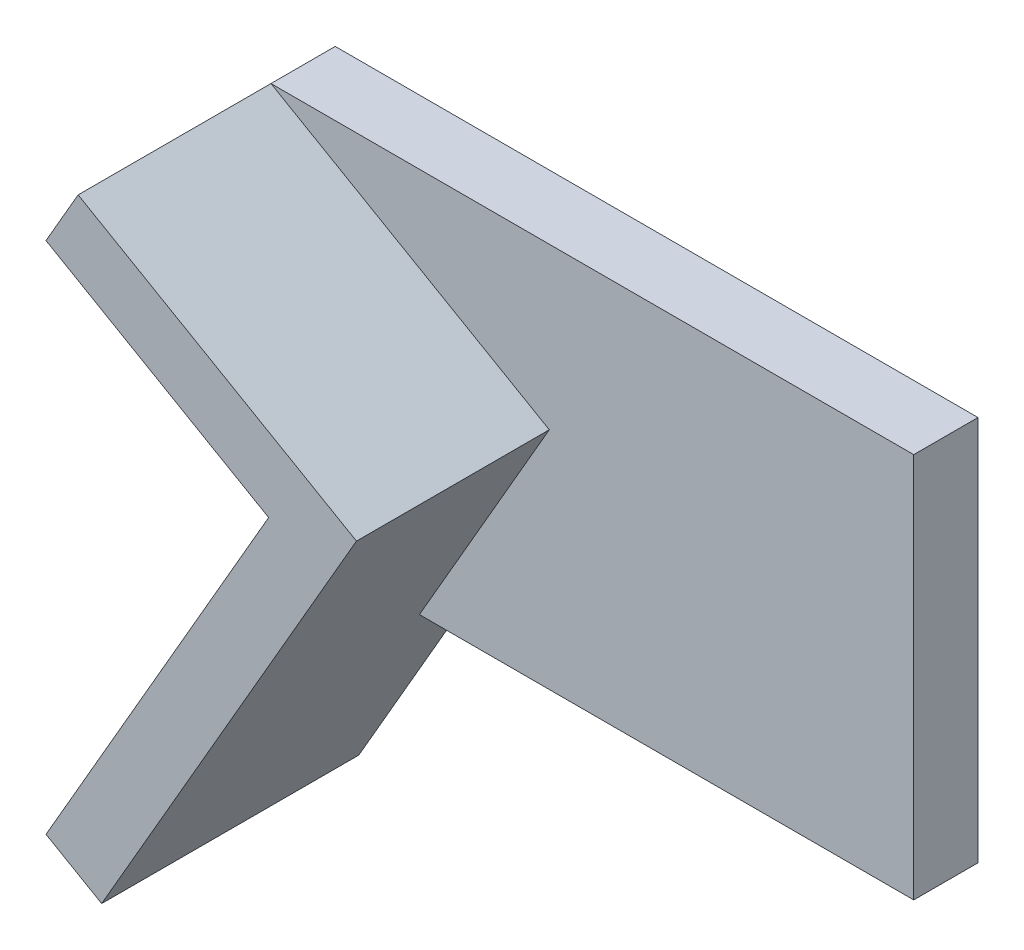
from build123d import *

# Parameters (mm, degrees)
BOSS_EXTRUDE1_DEPTH = 4
BOSS_EXTRUDE2_DEPTH = 1


with BuildPart() as part:
    # Sketch1 → Boss-Extrude1 (new body)
    with BuildSketch(Plane.XY):
        Polygon((0, 0), (3.464101615, 6), (0, 8), (0.5, 8.866025404), (4.830127019, 6.366025404), (0.866025404, -0.5), align=None)
    extrude(amount=BOSS_EXTRUDE1_DEPTH)

    # Sketch2 → Boss-Extrude2 (add)
    with BuildSketch(Plane(origin=(0, 0, 0), x_dir=(-1, 0, 0), z_dir=(0, 0, -1))):
        Polygon((-0.5, 8.866025404), (-10.5, 8.866025404), (-10.5, 2.866025404), (-2.809401077, 2.866025404), (-4.830127019, 6.366025404), align=None)
    extrude(amount=-BOSS_EXTRUDE2_DEPTH)


solid = part.part
